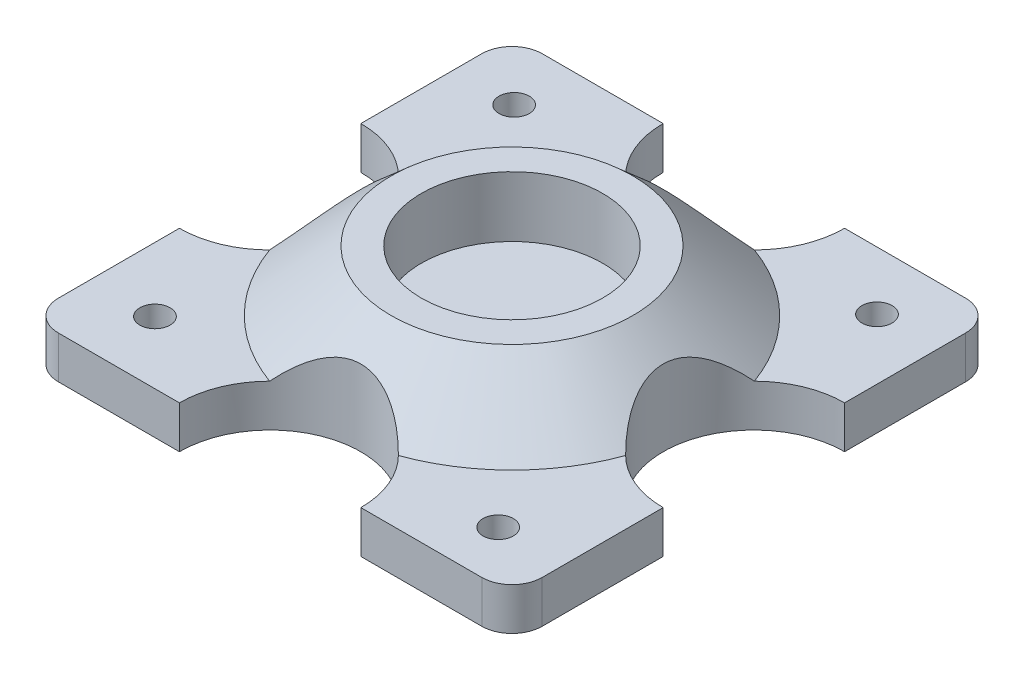
from build123d import *

# Parameters (mm, degrees)
BOSS_EXTRUDE1_DEPTH = 8.89
SKETCH3_R           = 19.05
SKETCH3_R_2         = 3.175
CUT_EXTRUDE5_DEPTH  = 59.944
SKETCH3_9_R         = 19.05
SKETCH3_9_R_2       = 3.175
CUT_EXTRUDE7_DEPTH  = 71.374
SKETCH3_12_R        = 19.05
BOSS_EXTRUDE2_DEPTH = 8.89


with BuildPart() as part:
    # Sketch1 → Boss-Extrude1 (new body)
    with BuildSketch(Plane(origin=(0, 0, 0), x_dir=(1, 0, 0), z_dir=(0, 1, 0))):
        with BuildLine():
            Line((-44.45, 50.8), (44.45, 50.8))
            ThreePointArc((44.45, 50.8), (48.940128061, 48.940128061), (50.8, 44.45))
            Line((50.8, 44.45), (50.8, -44.45))
            ThreePointArc((50.8, -44.45), (48.940128061, -48.940128061), (44.45, -50.8))
            Line((44.45, -50.8), (-44.45, -50.8))
            ThreePointArc((-44.45, -50.8), (-48.940128061, -48.940128061), (-50.8, -44.45))
            Line((-50.8, -44.45), (-50.8, 44.45))
            ThreePointArc((-50.8, 44.45), (-48.940128061, 48.940128061), (-44.45, 50.8))
        make_face()
    extrude(amount=BOSS_EXTRUDE1_DEPTH)

    # Sketch2 → Revolve1 (revolve)
    with BuildSketch(Plane.XY, mode=Mode.PRIVATE) as revolve1_sk:
        Polygon((0, 0), (0, 21.59), (25.4, 21.59), (41.275, 7.544465781), align=None)
    revolve(revolve1_sk.sketch.rotate(Axis((0, 0, 0), (0, 1, 0)), 90), axis=Axis((0, 0, 0), (0, 1, 0)))

    # Sketch3 → Cut-Extrude5 (cut)
    with BuildSketch(Plane(origin=(0, 0, 0), x_dir=(1, 0, 0), z_dir=(0, 1, 0))):
        with Locations((-50.8, 0)):
            Circle(SKETCH3_R)
        with Locations((50.8, 0)):
            Circle(SKETCH3_R)
        with Locations((0, 50.8)):
            Circle(SKETCH3_R)
        with Locations((0, -50.8)):
            Circle(SKETCH3_R)
        with Locations(Location((-38.1, 38.550826986, 0), (0, 0, 270))):
            Circle(SKETCH3_R_2)
        with Locations(Location((38.1, 38.550826986, 0), (0, 0, 270))):
            Circle(SKETCH3_R_2)
        with Locations(Location((37.0502476, -39.95194326, 0), (0, 0, 270))):
            Circle(SKETCH3_R_2)
        with Locations(Location((-37.332084064, -37.649173014, 0), (0, 0, 270))):
            Circle(SKETCH3_R_2)
    extrude(amount=CUT_EXTRUDE5_DEPTH, mode=Mode.SUBTRACT)

    # Sketch3<9> → Cut-Extrude7 (cut)
    with BuildSketch(Plane(origin=(0, 0, 0), x_dir=(1, 0, 0), z_dir=(0, 1, 0))):
        with Locations((-50.8, 0)):
            Circle(SKETCH3_9_R)
        with Locations(Location((0, 0, 0), (0, 0, 270))):
            Circle(SKETCH3_9_R)
        with Locations((50.8, 0)):
            Circle(SKETCH3_9_R)
        with Locations((0, 50.8)):
            Circle(SKETCH3_9_R)
        with Locations((0, -50.8)):
            Circle(SKETCH3_9_R)
        with Locations(Location((-38.1, 38.550826986, 0), (0, 0, 270))):
            Circle(SKETCH3_9_R_2)
        with Locations(Location((38.1, 38.550826986, 0), (0, 0, 270))):
            Circle(SKETCH3_9_R_2)
        with Locations(Location((37.0502476, -39.95194326, 0), (0, 0, 270))):
            Circle(SKETCH3_9_R_2)
        with Locations(Location((-37.332084064, -37.649173014, 0), (0, 0, 270))):
            Circle(SKETCH3_9_R_2)
    extrude(amount=CUT_EXTRUDE7_DEPTH, mode=Mode.SUBTRACT)

    # Sketch3<12> → Boss-Extrude2 (add)
    with BuildSketch(Plane(origin=(0, 0, 0), x_dir=(1, 0, 0), z_dir=(0, 1, 0))):
        with Locations(Location((0, 0, 0), (0, 0, 270))):
            Circle(SKETCH3_12_R)
    extrude(amount=BOSS_EXTRUDE2_DEPTH)


solid = part.part
